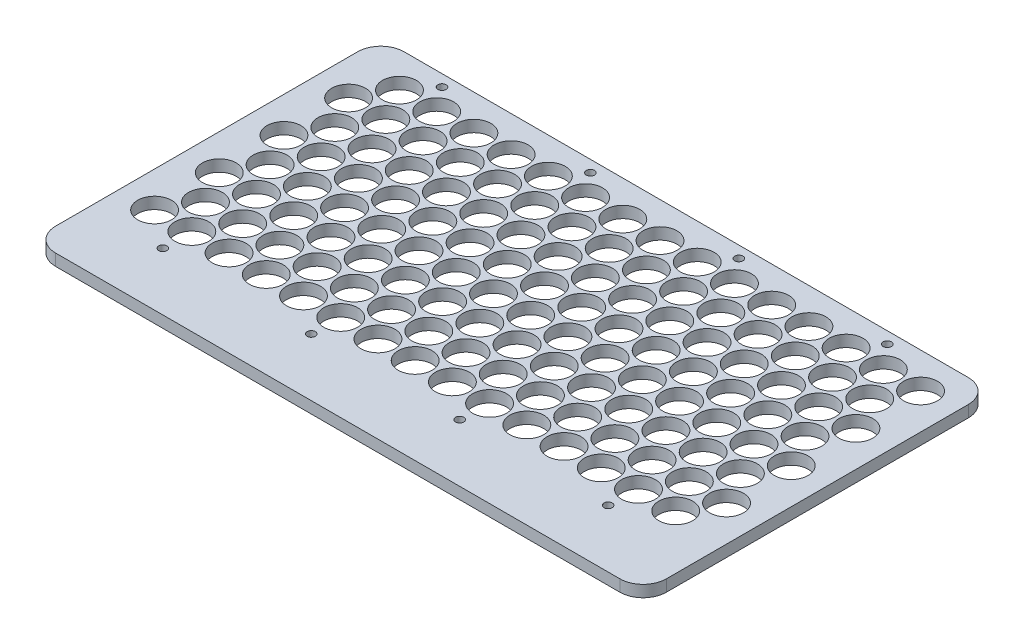
from build123d import *

# Parameters (mm, degrees)
SKETCH1_W            = 333.46
SKETCH1_H            = 190.275636205
SKETCH1_R            = 9.25
BOSS_EXTRUDE1_DEPTH  = 6.35
FILLET1_R            = 12.7
M4_CLEARANCE_HOLE2_D = 4.5


with BuildPart() as part:
    # Sketch1 → Boss-Extrude1 (new body)
    with BuildSketch(Plane(origin=(0, 0, 0), x_dir=(1, 0, 0), z_dir=(0, 1, 0))):
        with Locations((147.32, 47.787818103)):
            Rectangle(SKETCH1_W, SKETCH1_H)
        with Locations(Location((0, 0, 0), (0, 0, 270))):
            Circle(SKETCH1_R, mode=Mode.SUBTRACT)
        with Locations(Location((20.32, 0, 0), (0, 0, 270))):
            Circle(SKETCH1_R, mode=Mode.SUBTRACT)
        with Locations(Location((40.64, 0, 0), (0, 0, 270))):
            Circle(SKETCH1_R, mode=Mode.SUBTRACT)
        with Locations(Location((60.96, 0, 0), (0, 0, 270))):
            Circle(SKETCH1_R, mode=Mode.SUBTRACT)
        with Locations(Location((81.28, 0, 0), (0, 0, 270))):
            Circle(SKETCH1_R, mode=Mode.SUBTRACT)
        with Locations(Location((101.6, 0, 0), (0, 0, 270))):
            Circle(SKETCH1_R, mode=Mode.SUBTRACT)
        with Locations(Location((121.92, 0, 0), (0, 0, 270))):
            Circle(SKETCH1_R, mode=Mode.SUBTRACT)
        with Locations(Location((142.24, 0, 0), (0, 0, 270))):
            Circle(SKETCH1_R, mode=Mode.SUBTRACT)
        with Locations(Location((162.56, 0, 0), (0, 0, 270))):
            Circle(SKETCH1_R, mode=Mode.SUBTRACT)
        with Locations(Location((182.88, 0, 0), (0, 0, 270))):
            Circle(SKETCH1_R, mode=Mode.SUBTRACT)
        with Locations(Location((203.2, 0, 0), (0, 0, 270))):
            Circle(SKETCH1_R, mode=Mode.SUBTRACT)
        with Locations(Location((223.52, 0, 0), (0, 0, 270))):
            Circle(SKETCH1_R, mode=Mode.SUBTRACT)
        with Locations(Location((243.84, 0, 0), (0, 0, 270))):
            Circle(SKETCH1_R, mode=Mode.SUBTRACT)
        with Locations(Location((264.16, 0, 0), (0, 0, 270))):
            Circle(SKETCH1_R, mode=Mode.SUBTRACT)
        with Locations(Location((284.48, 0, 0), (0, 0, 270))):
            Circle(SKETCH1_R, mode=Mode.SUBTRACT)
        with Locations(Location((30.48, 17.597636205, 0), (0, 0, 270))):
            Circle(SKETCH1_R, mode=Mode.SUBTRACT)
        with Locations(Location((50.8, 17.597636205, 0), (0, 0, 270))):
            Circle(SKETCH1_R, mode=Mode.SUBTRACT)
        with Locations(Location((71.12, 17.597636205, 0), (0, 0, 270))):
            Circle(SKETCH1_R, mode=Mode.SUBTRACT)
        with Locations(Location((91.44, 17.597636205, 0), (0, 0, 270))):
            Circle(SKETCH1_R, mode=Mode.SUBTRACT)
        with Locations(Location((111.76, 17.597636205, 0), (0, 0, 270))):
            Circle(SKETCH1_R, mode=Mode.SUBTRACT)
        with Locations(Location((132.08, 17.597636205, 0), (0, 0, 270))):
            Circle(SKETCH1_R, mode=Mode.SUBTRACT)
        with Locations(Location((152.4, 17.597636205, 0), (0, 0, 270))):
            Circle(SKETCH1_R, mode=Mode.SUBTRACT)
        with Locations(Location((172.72, 17.597636205, 0), (0, 0, 270))):
            Circle(SKETCH1_R, mode=Mode.SUBTRACT)
        with Locations(Location((193.04, 17.597636205, 0), (0, 0, 270))):
            Circle(SKETCH1_R, mode=Mode.SUBTRACT)
        with Locations(Location((213.36, 17.597636205, 0), (0, 0, 270))):
            Circle(SKETCH1_R, mode=Mode.SUBTRACT)
        with Locations(Location((233.68, 17.597636205, 0), (0, 0, 270))):
            Circle(SKETCH1_R, mode=Mode.SUBTRACT)
        with Locations(Location((254, 17.597636205, 0), (0, 0, 270))):
            Circle(SKETCH1_R, mode=Mode.SUBTRACT)
        with Locations(Location((274.32, 17.597636205, 0), (0, 0, 270))):
            Circle(SKETCH1_R, mode=Mode.SUBTRACT)
        with Locations(Location((294.64, 17.597636205, 0), (0, 0, 270))):
            Circle(SKETCH1_R, mode=Mode.SUBTRACT)
        with Locations(Location((10.16, 17.597636205, 0), (0, 0, 270))):
            Circle(SKETCH1_R, mode=Mode.SUBTRACT)
        with Locations(Location((0, 35.306, 0), (0, 0, 270))):
            Circle(SKETCH1_R, mode=Mode.SUBTRACT)
        with Locations(Location((20.32, 35.306, 0), (0, 0, 270))):
            Circle(SKETCH1_R, mode=Mode.SUBTRACT)
        with Locations(Location((40.64, 35.306, 0), (0, 0, 270))):
            Circle(SKETCH1_R, mode=Mode.SUBTRACT)
        with Locations(Location((60.96, 35.306, 0), (0, 0, 270))):
            Circle(SKETCH1_R, mode=Mode.SUBTRACT)
        with Locations(Location((81.28, 35.306, 0), (0, 0, 270))):
            Circle(SKETCH1_R, mode=Mode.SUBTRACT)
        with Locations(Location((101.6, 35.306, 0), (0, 0, 270))):
            Circle(SKETCH1_R, mode=Mode.SUBTRACT)
        with Locations(Location((121.92, 35.306, 0), (0, 0, 270))):
            Circle(SKETCH1_R, mode=Mode.SUBTRACT)
        with Locations(Location((142.24, 35.306, 0), (0, 0, 270))):
            Circle(SKETCH1_R, mode=Mode.SUBTRACT)
        with Locations(Location((162.56, 35.306, 0), (0, 0, 270))):
            Circle(SKETCH1_R, mode=Mode.SUBTRACT)
        with Locations(Location((182.88, 35.306, 0), (0, 0, 270))):
            Circle(SKETCH1_R, mode=Mode.SUBTRACT)
        with Locations(Location((203.2, 35.306, 0), (0, 0, 270))):
            Circle(SKETCH1_R, mode=Mode.SUBTRACT)
        with Locations(Location((223.52, 35.306, 0), (0, 0, 270))):
            Circle(SKETCH1_R, mode=Mode.SUBTRACT)
        with Locations(Location((243.84, 35.306, 0), (0, 0, 270))):
            Circle(SKETCH1_R, mode=Mode.SUBTRACT)
        with Locations(Location((264.16, 35.306, 0), (0, 0, 270))):
            Circle(SKETCH1_R, mode=Mode.SUBTRACT)
        with Locations(Location((284.48, 35.306, 0), (0, 0, 270))):
            Circle(SKETCH1_R, mode=Mode.SUBTRACT)
        with Locations(Location((30.48, 52.903636205, 0), (0, 0, 270))):
            Circle(SKETCH1_R, mode=Mode.SUBTRACT)
        with Locations(Location((50.8, 52.903636205, 0), (0, 0, 270))):
            Circle(SKETCH1_R, mode=Mode.SUBTRACT)
        with Locations(Location((71.12, 52.903636205, 0), (0, 0, 270))):
            Circle(SKETCH1_R, mode=Mode.SUBTRACT)
        with Locations(Location((91.44, 52.903636205, 0), (0, 0, 270))):
            Circle(SKETCH1_R, mode=Mode.SUBTRACT)
        with Locations(Location((111.76, 52.903636205, 0), (0, 0, 270))):
            Circle(SKETCH1_R, mode=Mode.SUBTRACT)
        with Locations(Location((132.08, 52.903636205, 0), (0, 0, 270))):
            Circle(SKETCH1_R, mode=Mode.SUBTRACT)
        with Locations(Location((152.4, 52.903636205, 0), (0, 0, 270))):
            Circle(SKETCH1_R, mode=Mode.SUBTRACT)
        with Locations(Location((172.72, 52.903636205, 0), (0, 0, 270))):
            Circle(SKETCH1_R, mode=Mode.SUBTRACT)
        with Locations(Location((193.04, 52.903636205, 0), (0, 0, 270))):
            Circle(SKETCH1_R, mode=Mode.SUBTRACT)
        with Locations(Location((213.36, 52.903636205, 0), (0, 0, 270))):
            Circle(SKETCH1_R, mode=Mode.SUBTRACT)
        with Locations(Location((233.68, 52.903636205, 0), (0, 0, 270))):
            Circle(SKETCH1_R, mode=Mode.SUBTRACT)
        with Locations(Location((254, 52.903636205, 0), (0, 0, 270))):
            Circle(SKETCH1_R, mode=Mode.SUBTRACT)
        with Locations(Location((274.32, 52.903636205, 0), (0, 0, 270))):
            Circle(SKETCH1_R, mode=Mode.SUBTRACT)
        with Locations(Location((294.64, 52.903636205, 0), (0, 0, 270))):
            Circle(SKETCH1_R, mode=Mode.SUBTRACT)
        with Locations(Location((10.16, 52.903636205, 0), (0, 0, 270))):
            Circle(SKETCH1_R, mode=Mode.SUBTRACT)
        with Locations(Location((0, 70.612, 0), (0, 0, 270))):
            Circle(SKETCH1_R, mode=Mode.SUBTRACT)
        with Locations(Location((20.32, 70.612, 0), (0, 0, 270))):
            Circle(SKETCH1_R, mode=Mode.SUBTRACT)
        with Locations(Location((40.64, 70.612, 0), (0, 0, 270))):
            Circle(SKETCH1_R, mode=Mode.SUBTRACT)
        with Locations(Location((60.96, 70.612, 0), (0, 0, 270))):
            Circle(SKETCH1_R, mode=Mode.SUBTRACT)
        with Locations(Location((81.28, 70.612, 0), (0, 0, 270))):
            Circle(SKETCH1_R, mode=Mode.SUBTRACT)
        with Locations(Location((101.6, 70.612, 0), (0, 0, 270))):
            Circle(SKETCH1_R, mode=Mode.SUBTRACT)
        with Locations(Location((121.92, 70.612, 0), (0, 0, 270))):
            Circle(SKETCH1_R, mode=Mode.SUBTRACT)
        with Locations(Location((142.24, 70.612, 0), (0, 0, 270))):
            Circle(SKETCH1_R, mode=Mode.SUBTRACT)
        with Locations(Location((162.56, 70.612, 0), (0, 0, 270))):
            Circle(SKETCH1_R, mode=Mode.SUBTRACT)
        with Locations(Location((182.88, 70.612, 0), (0, 0, 270))):
            Circle(SKETCH1_R, mode=Mode.SUBTRACT)
        with Locations(Location((203.2, 70.612, 0), (0, 0, 270))):
            Circle(SKETCH1_R, mode=Mode.SUBTRACT)
        with Locations(Location((223.52, 70.612, 0), (0, 0, 270))):
            Circle(SKETCH1_R, mode=Mode.SUBTRACT)
        with Locations(Location((243.84, 70.612, 0), (0, 0, 270))):
            Circle(SKETCH1_R, mode=Mode.SUBTRACT)
        with Locations(Location((264.16, 70.612, 0), (0, 0, 270))):
            Circle(SKETCH1_R, mode=Mode.SUBTRACT)
        with Locations(Location((284.48, 70.612, 0), (0, 0, 270))):
            Circle(SKETCH1_R, mode=Mode.SUBTRACT)
        with Locations(Location((30.48, 88.209636205, 0), (0, 0, 270))):
            Circle(SKETCH1_R, mode=Mode.SUBTRACT)
        with Locations(Location((50.8, 88.209636205, 0), (0, 0, 270))):
            Circle(SKETCH1_R, mode=Mode.SUBTRACT)
        with Locations(Location((71.12, 88.209636205, 0), (0, 0, 270))):
            Circle(SKETCH1_R, mode=Mode.SUBTRACT)
        with Locations(Location((91.44, 88.209636205, 0), (0, 0, 270))):
            Circle(SKETCH1_R, mode=Mode.SUBTRACT)
        with Locations(Location((111.76, 88.209636205, 0), (0, 0, 270))):
            Circle(SKETCH1_R, mode=Mode.SUBTRACT)
        with Locations(Location((132.08, 88.209636205, 0), (0, 0, 270))):
            Circle(SKETCH1_R, mode=Mode.SUBTRACT)
        with Locations(Location((152.4, 88.209636205, 0), (0, 0, 270))):
            Circle(SKETCH1_R, mode=Mode.SUBTRACT)
        with Locations(Location((172.72, 88.209636205, 0), (0, 0, 270))):
            Circle(SKETCH1_R, mode=Mode.SUBTRACT)
        with Locations(Location((193.04, 88.209636205, 0), (0, 0, 270))):
            Circle(SKETCH1_R, mode=Mode.SUBTRACT)
        with Locations(Location((213.36, 88.209636205, 0), (0, 0, 270))):
            Circle(SKETCH1_R, mode=Mode.SUBTRACT)
        with Locations(Location((233.68, 88.209636205, 0), (0, 0, 270))):
            Circle(SKETCH1_R, mode=Mode.SUBTRACT)
        with Locations(Location((254, 88.209636205, 0), (0, 0, 270))):
            Circle(SKETCH1_R, mode=Mode.SUBTRACT)
        with Locations(Location((274.32, 88.209636205, 0), (0, 0, 270))):
            Circle(SKETCH1_R, mode=Mode.SUBTRACT)
        with Locations(Location((294.64, 88.209636205, 0), (0, 0, 270))):
            Circle(SKETCH1_R, mode=Mode.SUBTRACT)
        with Locations(Location((10.16, 88.209636205, 0), (0, 0, 270))):
            Circle(SKETCH1_R, mode=Mode.SUBTRACT)
        with Locations(Location((0, 105.918, 0), (0, 0, 270))):
            Circle(SKETCH1_R, mode=Mode.SUBTRACT)
        with Locations(Location((20.32, 105.918, 0), (0, 0, 270))):
            Circle(SKETCH1_R, mode=Mode.SUBTRACT)
        with Locations(Location((40.64, 105.918, 0), (0, 0, 270))):
            Circle(SKETCH1_R, mode=Mode.SUBTRACT)
        with Locations(Location((60.96, 105.918, 0), (0, 0, 270))):
            Circle(SKETCH1_R, mode=Mode.SUBTRACT)
        with Locations(Location((81.28, 105.918, 0), (0, 0, 270))):
            Circle(SKETCH1_R, mode=Mode.SUBTRACT)
        with Locations(Location((101.6, 105.918, 0), (0, 0, 270))):
            Circle(SKETCH1_R, mode=Mode.SUBTRACT)
        with Locations(Location((121.92, 105.918, 0), (0, 0, 270))):
            Circle(SKETCH1_R, mode=Mode.SUBTRACT)
        with Locations(Location((142.24, 105.918, 0), (0, 0, 270))):
            Circle(SKETCH1_R, mode=Mode.SUBTRACT)
        with Locations(Location((162.56, 105.918, 0), (0, 0, 270))):
            Circle(SKETCH1_R, mode=Mode.SUBTRACT)
        with Locations(Location((182.88, 105.918, 0), (0, 0, 270))):
            Circle(SKETCH1_R, mode=Mode.SUBTRACT)
        with Locations(Location((203.2, 105.918, 0), (0, 0, 270))):
            Circle(SKETCH1_R, mode=Mode.SUBTRACT)
        with Locations(Location((223.52, 105.918, 0), (0, 0, 270))):
            Circle(SKETCH1_R, mode=Mode.SUBTRACT)
        with Locations(Location((243.84, 105.918, 0), (0, 0, 270))):
            Circle(SKETCH1_R, mode=Mode.SUBTRACT)
        with Locations(Location((264.16, 105.918, 0), (0, 0, 270))):
            Circle(SKETCH1_R, mode=Mode.SUBTRACT)
        with Locations(Location((284.48, 105.918, 0), (0, 0, 270))):
            Circle(SKETCH1_R, mode=Mode.SUBTRACT)
        with Locations(Location((30.48, 123.515636205, 0), (0, 0, 270))):
            Circle(SKETCH1_R, mode=Mode.SUBTRACT)
        with Locations(Location((50.8, 123.515636205, 0), (0, 0, 270))):
            Circle(SKETCH1_R, mode=Mode.SUBTRACT)
        with Locations(Location((71.12, 123.515636205, 0), (0, 0, 270))):
            Circle(SKETCH1_R, mode=Mode.SUBTRACT)
        with Locations(Location((91.44, 123.515636205, 0), (0, 0, 270))):
            Circle(SKETCH1_R, mode=Mode.SUBTRACT)
        with Locations(Location((111.76, 123.515636205, 0), (0, 0, 270))):
            Circle(SKETCH1_R, mode=Mode.SUBTRACT)
        with Locations(Location((132.08, 123.515636205, 0), (0, 0, 270))):
            Circle(SKETCH1_R, mode=Mode.SUBTRACT)
        with Locations(Location((152.4, 123.515636205, 0), (0, 0, 270))):
            Circle(SKETCH1_R, mode=Mode.SUBTRACT)
        with Locations(Location((172.72, 123.515636205, 0), (0, 0, 270))):
            Circle(SKETCH1_R, mode=Mode.SUBTRACT)
        with Locations(Location((193.04, 123.515636205, 0), (0, 0, 270))):
            Circle(SKETCH1_R, mode=Mode.SUBTRACT)
        with Locations(Location((213.36, 123.515636205, 0), (0, 0, 270))):
            Circle(SKETCH1_R, mode=Mode.SUBTRACT)
        with Locations(Location((233.68, 123.515636205, 0), (0, 0, 270))):
            Circle(SKETCH1_R, mode=Mode.SUBTRACT)
        with Locations(Location((254, 123.515636205, 0), (0, 0, 270))):
            Circle(SKETCH1_R, mode=Mode.SUBTRACT)
        with Locations(Location((274.32, 123.515636205, 0), (0, 0, 270))):
            Circle(SKETCH1_R, mode=Mode.SUBTRACT)
        with Locations(Location((294.64, 123.515636205, 0), (0, 0, 270))):
            Circle(SKETCH1_R, mode=Mode.SUBTRACT)
        with Locations(Location((10.16, 123.515636205, 0), (0, 0, 270))):
            Circle(SKETCH1_R, mode=Mode.SUBTRACT)
    extrude(amount=BOSS_EXTRUDE1_DEPTH)

    # Fillet1
    fillet1_edges = [part.edges().sort_by_distance(p)[0] for p in [
        (-19.41, 3.175, -142.925636205),
        (314.05, 3.175, -142.925636205),
        (314.05, 3.175, 47.35),
        (-19.41, 3.175, 47.35),
    ]]
    fillet(fillet1_edges, radius=FILLET1_R)

    # M4 Clearance Hole2 (through all)
    with Locations(Plane(origin=(0, 6.35, 0), x_dir=(1, 0, 0), z_dir=(0, 1, 0))):
        with Locations((20.320000042, 136.575636205), (101.346000042, 136.575636205), (182.372000042, 136.575636205), (263.398000042, 136.575636205), (20.320000042, -15.824363795), (101.346000042, -15.824363795), (182.372000042, -15.824363795), (263.398000042, -15.824363795)):
            Hole(M4_CLEARANCE_HOLE2_D / 2)


solid = part.part
